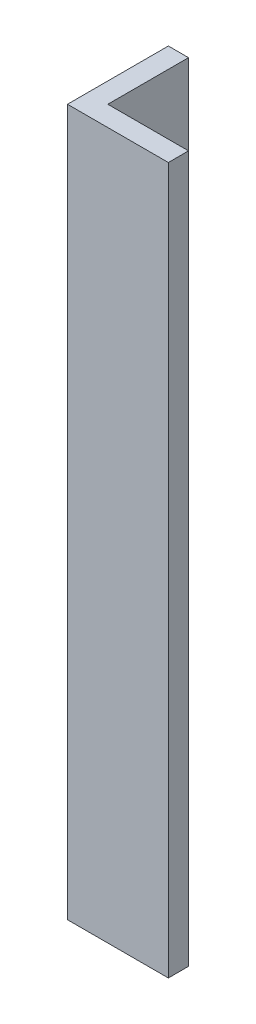
from build123d import *

# Parameters (mm, degrees)
EXTRUDE_1_DEPTH = 70


with BuildPart() as part:
    # 草图1 → 凸台-拉伸1 (new body)
    with BuildSketch(Plane(origin=(0, 0, 0), x_dir=(1, 0, 0), z_dir=(0, 1, 0))):
        Polygon((0, 0), (10, 0), (10, 2), (2, 2), (2, 10), (0, 10), align=None)
    extrude(amount=EXTRUDE_1_DEPTH)


solid = part.part
